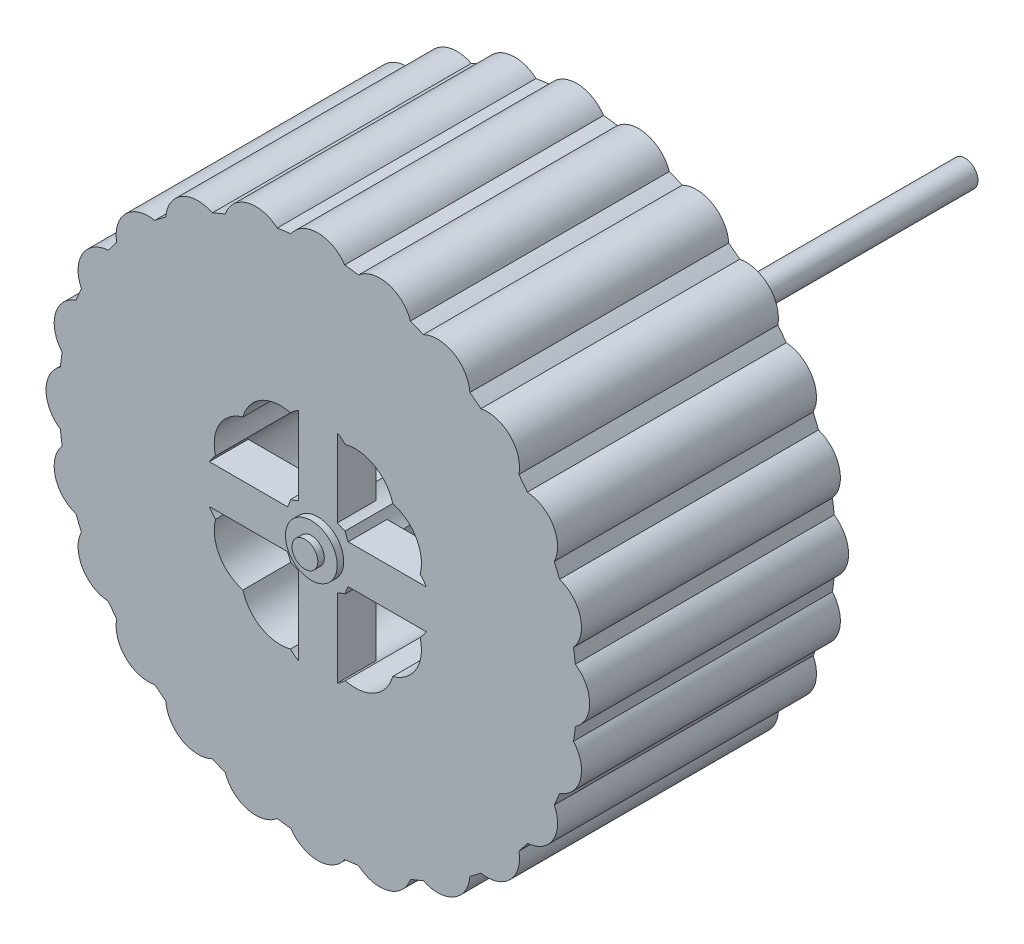
from build123d import *

# Parameters (mm, degrees)
SKETCH1_R            = 50.8
BOSS_EXTRUDE3_DEPTH  = 50.8
SKETCH5_R            = 7.62
CUT_EXTRUDE2_DEPTH   = 50.8
SKETCH6_W            = 101.31384703
SKETCH6_H            = 7.62
SKETCH6_W_2          = 7.62
SKETCH6_H_2          = 101.31384703
BOSS_EXTRUDE4_DEPTH  = 7.62
SKETCH7_R            = 5.08
BOSS_EXTRUDE5_DEPTH  = 1.27
SKETCH8_R            = 2.54
BOSS_EXTRUDE6_DEPTH  = 1.27
SKETCH9_R            = 2.54
BOSS_EXTRUDE7_DEPTH  = 76.2
SKETCH10_R           = 6.35
BOSS_EXTRUDE8_DEPTH  = 50.8
SKETCH11_W           = 7.62
SKETCH11_H           = 104.14
SKETCH11_W_2         = 104.14
SKETCH11_H_2         = 7.62
BOSS_EXTRUDE9_DEPTH  = 7.62
SKETCH12_R           = 6.35
BOSS_EXTRUDE10_DEPTH = 1.27


with BuildPart() as part:
    # Sketch1 → Boss-Extrude3 (new body)
    with BuildSketch(Plane.XY):
        Circle(SKETCH1_R)
    extrude(amount=BOSS_EXTRUDE3_DEPTH)

    # Sketch5 → Cut-Extrude2 (cut)
    with BuildSketch(Plane.XY.offset(50.8)):
        with Locations((0, 14.676826076)):
            Circle(SKETCH5_R)
        with Locations((7.338413038, 12.710504229)):
            Circle(SKETCH5_R)
        with Locations((12.710504229, 7.338413038)):
            Circle(SKETCH5_R)
        with Locations((14.676826076, 0)):
            Circle(SKETCH5_R)
        with Locations((12.710504229, -7.338413038)):
            Circle(SKETCH5_R)
        with Locations((7.338413038, -12.710504229)):
            Circle(SKETCH5_R)
        with Locations((0, -14.676826076)):
            Circle(SKETCH5_R)
        with Locations((-7.338413038, -12.710504229)):
            Circle(SKETCH5_R)
        with Locations((-12.710504229, -7.338413038)):
            Circle(SKETCH5_R)
        with Locations((-14.676826076, 0)):
            Circle(SKETCH5_R)
        with Locations((-12.710504229, 7.338413038)):
            Circle(SKETCH5_R)
        with Locations((-7.338413038, 12.710504229)):
            Circle(SKETCH5_R)
    extrude(amount=-CUT_EXTRUDE2_DEPTH, mode=Mode.SUBTRACT)


with BuildPart() as cut_extrude2_piece_1:
    # of the separate pieces the step leaves, piece 1, a body of its own (cut_extrude2_pieces)
    add(part.part.solids().sort_by_distance((50.8, 0, 0))[0])



with BuildPart() as cut_extrude2_piece_2:
    # of the separate pieces the step leaves, piece 2, a body of its own (cut_extrude2_pieces)
    add(part.part.solids().sort_by_distance((-5.35355304, 5.35355304, 0))[0])


with BuildPart() as cut_extrude2_piece_1_1:
    add(cut_extrude2_piece_1.part)

    add(cut_extrude2_piece_2.part)  # Boss-Extrude4 merges Cut-Extrude2 piece 2
    # Sketch6 → Boss-Extrude4 (add)
    with BuildSketch(Plane.XY.offset(50.8)):
        Rectangle(SKETCH6_W, SKETCH6_H)
        Rectangle(SKETCH6_W_2, SKETCH6_H_2)
    extrude(amount=-BOSS_EXTRUDE4_DEPTH)

    # Sketch7 → Boss-Extrude5 (add)
    with BuildSketch(Plane.XY.offset(50.8)):
        Circle(SKETCH7_R)
    extrude(amount=BOSS_EXTRUDE5_DEPTH)

    # Sketch8 → Boss-Extrude6 (add)
    with BuildSketch(Plane.XY.offset(52.07)):
        Circle(SKETCH8_R)
    extrude(amount=BOSS_EXTRUDE6_DEPTH)

    # Sketch9 → Boss-Extrude7 (add)
    with BuildSketch(Plane(origin=(0, 0, 0), x_dir=(-1, 0, 0), z_dir=(0, 0, -1))):
        with Locations(Location((0, 0, 0), (0, 0, 180))):
            Circle(SKETCH9_R)
    extrude(amount=BOSS_EXTRUDE7_DEPTH)

    # Sketch10 → Boss-Extrude8 (add)
    with BuildSketch(Plane.XY.offset(50.8)):
        with Locations((0, 46.99)):
            Circle(SKETCH10_R)
        with Locations((12.161906929, 45.388854577)):
            Circle(SKETCH10_R)
        with Locations((23.495, 40.694533724)):
            Circle(SKETCH10_R)
        with Locations((33.226947648, 33.226947648)):
            Circle(SKETCH10_R)
        with Locations((40.694533724, 23.495)):
            Circle(SKETCH10_R)
        with Locations((45.388854577, 12.161906929)):
            Circle(SKETCH10_R)
        with Locations((46.99, 0)):
            Circle(SKETCH10_R)
        with Locations((45.388854577, -12.161906929)):
            Circle(SKETCH10_R)
        with Locations((40.694533724, -23.495)):
            Circle(SKETCH10_R)
        with Locations((33.226947648, -33.226947648)):
            Circle(SKETCH10_R)
        with Locations((23.495, -40.694533724)):
            Circle(SKETCH10_R)
        with Locations((12.161906929, -45.388854577)):
            Circle(SKETCH10_R)
        with Locations((0, -46.99)):
            Circle(SKETCH10_R)
        with Locations((-12.161906929, -45.388854577)):
            Circle(SKETCH10_R)
        with Locations((-23.495, -40.694533724)):
            Circle(SKETCH10_R)
        with Locations((-33.226947648, -33.226947648)):
            Circle(SKETCH10_R)
        with Locations((-40.694533724, -23.495)):
            Circle(SKETCH10_R)
        with Locations((-45.388854577, -12.161906929)):
            Circle(SKETCH10_R)
        with Locations((-46.99, 0)):
            Circle(SKETCH10_R)
        with Locations((-45.388854577, 12.161906929)):
            Circle(SKETCH10_R)
        with Locations((-40.694533724, 23.495)):
            Circle(SKETCH10_R)
        with Locations((-33.226947648, 33.226947648)):
            Circle(SKETCH10_R)
        with Locations((-23.495, 40.694533724)):
            Circle(SKETCH10_R)
        with Locations((-12.161906929, 45.388854577)):
            Circle(SKETCH10_R)
    extrude(amount=-BOSS_EXTRUDE8_DEPTH)

    # Sketch11 → Boss-Extrude9 (add)
    with BuildSketch(Plane(origin=(0, 0, 0), x_dir=(-1, 0, 0), z_dir=(0, 0, -1))):
        Rectangle(SKETCH11_W, SKETCH11_H)
        Rectangle(SKETCH11_W_2, SKETCH11_H_2)
    extrude(amount=-BOSS_EXTRUDE9_DEPTH)

    # Sketch12 → Boss-Extrude10 (add)
    with BuildSketch(Plane(origin=(0, 0, 0), x_dir=(-1, 0, 0), z_dir=(0, 0, -1))):
        with Locations(Location((0, 0, 0), (0, 0, 180))):
            Circle(SKETCH12_R)
    extrude(amount=BOSS_EXTRUDE10_DEPTH)


solid = cut_extrude2_piece_1_1.part
